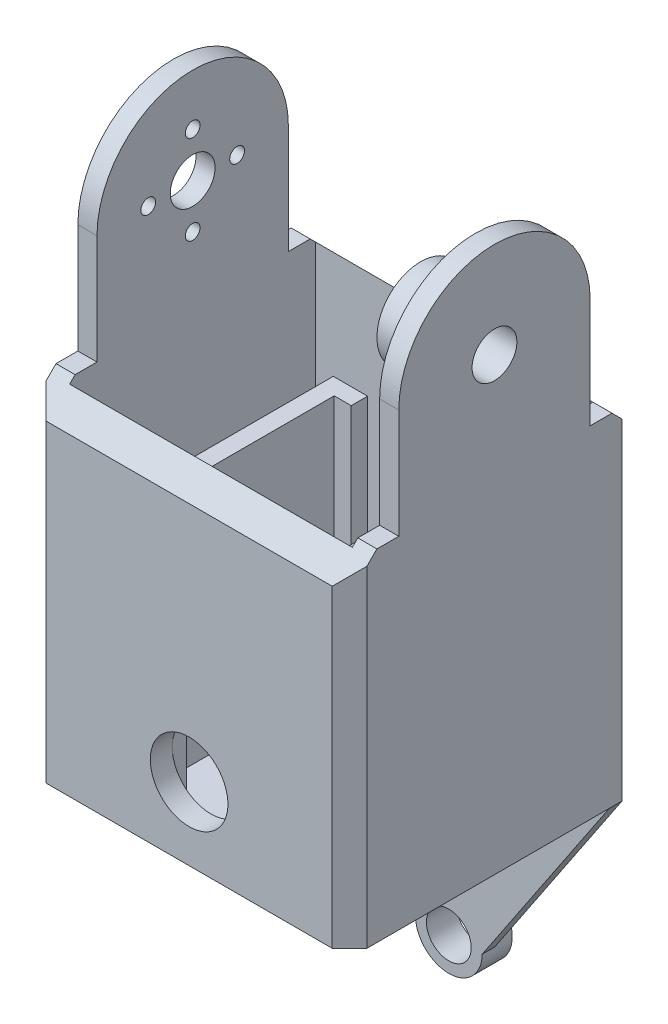
from build123d import *

# Parameters (mm, degrees)
SKETCH1_R                = 4.1
BOSS_EXTRUDE1_DEPTH      = 3.5
BOSS_EXTRUDE2_DEPTH      = 51.7
BOSS_EXTRUDE2_DEPTH_BACK = 3.5
CHAMFER2_SIZE            = 5
CUT_EXTRUDE1_REACH       = 112.079
SKETCH4_W                = 51.7
SKETCH4_H                = 45
BOSS_EXTRUDE3_START      = 3.5
SKETCH5_R                = 4.1
BOSS_EXTRUDE3_DEPTH      = 3.5
CUT_EXTRUDE3_REACH       = 104.062
SKETCH9_R                = 1.35
SKETCH10_W               = 58.7
SKETCH10_H               = 53
BOSS_EXTRUDE5_DEPTH      = 3.175
SKETCH26_R               = 7.1
CUT_EXTRUDE6_DEPTH       = 4
SKETCH27_W               = 3.175
SKETCH27_H               = 34.600130378
BOSS_EXTRUDE6_DEPTH      = 45.22
SKETCH29_R               = 4.1
BOSS_EXTRUDE8_DEPTH      = 5.5
CHAMFER3_SIZE            = 3.175
BOSS_EXTRUDE9_START      = 10
SKETCH30_R               = 8
SKETCH30_R_2             = 4.1
BOSS_EXTRUDE9_DEPTH      = 10
SKETCH31_R               = 0.95
CUT_EXTRUDE7_DEPTH       = 120.972242206
BOSS_EXTRUDE10_DEPTH     = 45.22
SKETCH33_W               = 5.386290257
SKETCH33_H               = 2.7
BOSS_EXTRUDE11_DEPTH     = 45.22
BOSS_EXTRUDE12_DEPTH     = 0.2


with BuildPart() as part:
    # Sketch1 → Boss-Extrude1 (new body)
    with BuildSketch(Plane(origin=(0, 0, 0), x_dir=(0, 0, -1), z_dir=(1, 0, 0))):
        with BuildLine():
            Line((-17.5, 0), (-17.5, -20))
            Line((-17.5, -20), (-22.5, -20))
            Line((-22.5, -20), (-22.5, -76))
            Line((-22.5, -76), (22.5, -76))
            Line((22.5, -76), (22.5, -20))
            Line((22.5, -20), (17.5, -20))
            Line((17.5, -20), (17.5, 0))
            ThreePointArc((17.5, 0), (0, 17.5), (-17.5, 0))
        make_face()
        Circle(SKETCH1_R, mode=Mode.SUBTRACT)
    extrude(amount=-BOSS_EXTRUDE1_DEPTH)

    # Sketch2 → Boss-Extrude2 (add, two sides: drawn at the far end of the back side and taken through both)
    with BuildSketch(Plane(origin=(0, 0, 0), x_dir=(0, 0, -1), z_dir=(1, 0, 0)).offset(-BOSS_EXTRUDE2_DEPTH_BACK)):
        Polygon((-22.5, -20), (-22.5, -76), (22.5, -76), (22.5, -20), (26.5, -20), (26.5, -79.175), (-26.5, -79.175), (-26.5, -20), align=None)
    extrude(amount=BOSS_EXTRUDE2_DEPTH + BOSS_EXTRUDE2_DEPTH_BACK)

    # Chamfer2
    chamfer2_edges = [part.edges().sort_by_distance(p)[0] for p in [
        (24.1, -20, -26.5),
        (24.1, -20, 26.5),
    ]]
    chamfer(chamfer2_edges, length=CHAMFER2_SIZE)

    # Sketch4 → Cut-Extrude1 (cut, up to next)
    with BuildSketch(Plane(origin=(0, -76, 0), x_dir=(1, 0, 0), z_dir=(0, 1, 0)), mode=Mode.PRIVATE) as cut_extrude1_sk1:
        with Locations((25.85, 0)):
            Rectangle(SKETCH4_W, SKETCH4_H)
    cut_extrude1_tool1 = extrude(cut_extrude1_sk1.sketch, amount=-CUT_EXTRUDE1_REACH, mode=Mode.PRIVATE) & part.part
    add(cut_extrude1_tool1.solids().sort_by_distance((25.85, -76, 0))[0], mode=Mode.SUBTRACT)

    # Sketch5 → Boss-Extrude3 (add)
    with BuildSketch(Plane(origin=(51.7, 0, 0), x_dir=(0, 0, -1), z_dir=(1, 0, 0)).offset(BOSS_EXTRUDE3_START)):
        with BuildLine():
            Line((21.5, -20), (17.5, -20))
            Line((17.5, -20), (17.5, 0))
            ThreePointArc((17.5, 0), (0, 17.5), (-17.5, 0))
            Line((-17.5, 0), (-17.5, -20))
            Line((-17.5, -20), (-21.5, -20))
            Line((-21.5, -20), (-26.5, -25))
            Line((-26.5, -25), (-26.5, -79.175))
            Line((-26.5, -79.175), (26.5, -79.175))
            Line((26.5, -79.175), (26.5, -25))
            Line((26.5, -25), (21.5, -20))
        make_face()
        Circle(SKETCH5_R, mode=Mode.SUBTRACT)
    extrude(amount=-BOSS_EXTRUDE3_DEPTH)

    # Sketch9 → Cut-Extrude3 (cut, up to next)
    with BuildSketch(Plane(origin=(55.2, 0, 0), x_dir=(0, 0, -1), z_dir=(1, 0, 0)), mode=Mode.PRIVATE) as cut_extrude3_sk1:
        with Locations((0, 8.125)):
            Circle(SKETCH9_R)
    cut_extrude3_tool1 = extrude(cut_extrude3_sk1.sketch, amount=-CUT_EXTRUDE3_REACH, mode=Mode.PRIVATE) & part.part
    # Sketch9 → Cut-Extrude3 (cut, up to next)
    with BuildSketch(Plane(origin=(55.2, 0, 0), x_dir=(0, 0, -1), z_dir=(1, 0, 0)), mode=Mode.PRIVATE) as cut_extrude3_sk2:
        with Locations((8.125, 0)):
            Circle(SKETCH9_R)
    cut_extrude3_tool2 = extrude(cut_extrude3_sk2.sketch, amount=-CUT_EXTRUDE3_REACH, mode=Mode.PRIVATE) & part.part
    # Sketch9 → Cut-Extrude3 (cut, up to next)
    with BuildSketch(Plane(origin=(55.2, 0, 0), x_dir=(0, 0, -1), z_dir=(1, 0, 0)), mode=Mode.PRIVATE) as cut_extrude3_sk3:
        with Locations((0, -8.125)):
            Circle(SKETCH9_R)
    cut_extrude3_tool3 = extrude(cut_extrude3_sk3.sketch, amount=-CUT_EXTRUDE3_REACH, mode=Mode.PRIVATE) & part.part
    # Sketch9 → Cut-Extrude3 (cut, up to next)
    with BuildSketch(Plane(origin=(55.2, 0, 0), x_dir=(0, 0, -1), z_dir=(1, 0, 0)), mode=Mode.PRIVATE) as cut_extrude3_sk4:
        with Locations((-8.125, 0)):
            Circle(SKETCH9_R)
    cut_extrude3_tool4 = extrude(cut_extrude3_sk4.sketch, amount=-CUT_EXTRUDE3_REACH, mode=Mode.PRIVATE) & part.part
    add(cut_extrude3_tool1.solids().sort_by_distance((55.2, 8.125, 0))[0], mode=Mode.SUBTRACT)
    add(cut_extrude3_tool2.solids().sort_by_distance((55.2, 0, -8.125))[0], mode=Mode.SUBTRACT)
    add(cut_extrude3_tool3.solids().sort_by_distance((55.2, -8.125, 0))[0], mode=Mode.SUBTRACT)
    add(cut_extrude3_tool4.solids().sort_by_distance((55.2, 0, 8.125))[0], mode=Mode.SUBTRACT)

    # Sketch10 → Boss-Extrude5 (add)
    with BuildSketch(Plane.XZ.offset(79.175)):
        with Locations((25.85, 0)):
            Rectangle(SKETCH10_W, SKETCH10_H)
    extrude(amount=BOSS_EXTRUDE5_DEPTH)

    # Sketch26 → Cut-Extrude6 (cut)
    with BuildSketch(Plane.XY.offset(26.5)):
        with Locations((25.85, -69.065)):
            Circle(SKETCH26_R)
    extrude(amount=-CUT_EXTRUDE6_DEPTH, mode=Mode.SUBTRACT)

    # Sketch27 → Boss-Extrude6 (add)
    with BuildSketch(Plane(origin=(0, -79.175, 0), x_dir=(1, 0, 0), z_dir=(0, 1, 0))):
        with Locations((39.993724488, -5.199934811)):
            Rectangle(SKETCH27_W, SKETCH27_H)
        with Locations((11.706275512, -5.199934811)):
            Rectangle(SKETCH27_W, SKETCH27_H)
    extrude(amount=BOSS_EXTRUDE6_DEPTH)

    # Sketch29 → Boss-Extrude8 (add)
    with BuildSketch(Plane(origin=(0, 0, -26.5), x_dir=(-1, 0, 0), z_dir=(0, 0, -1))):
        with BuildLine():
            Line((-40.997321429, -82.35), (-55.2, -82.35))
            Line((-55.2, -82.35), (-31.95, -117.07))
            ThreePointArc((-31.95, -117.07), (-25.85, -123.17), (-19.75, -117.07))
            Line((-19.75, -117.07), (3.5, -82.35))
            Line((3.5, -82.35), (-10.702678571, -82.35))
            Line((-10.702678571, -82.35), (-10.702678571, -88.35))
            Line((-10.702678571, -88.35), (-20.85, -103.503333333))
            Line((-20.85, -103.503333333), (-30.85, -103.503333333))
            Line((-30.85, -103.503333333), (-40.997321429, -88.35))
            Line((-40.997321429, -88.35), (-40.997321429, -82.35))
        make_face()
        with Locations(Location((-25.85, -117.07, 0), (0, 0, 90))):
            Circle(SKETCH29_R, mode=Mode.SUBTRACT)
    extrude(amount=-BOSS_EXTRUDE8_DEPTH)

    # Chamfer3
    chamfer3_edges = [part.edges().sort_by_distance(p)[0] for p in [
        (43.575, -99.71, -26.5),
        (8.125, -99.71, -26.5),
        (-3.5, -53.675, -26.5),
        (-3.5, -53.675, 26.5),
        (55.2, -53.675, 26.5),
        (55.2, -53.675, -26.5),
    ]]
    chamfer(chamfer3_edges, length=CHAMFER3_SIZE)

    # Sketch30 → Boss-Extrude9 (add)
    with BuildSketch(Plane(origin=(0, 0, 0), x_dir=(0, 0, -1), z_dir=(1, 0, 0)).offset(BOSS_EXTRUDE9_START)):
        Circle(SKETCH30_R)
        Circle(SKETCH30_R_2, mode=Mode.SUBTRACT)
    extrude(amount=-BOSS_EXTRUDE9_DEPTH)

    # Sketch31 → Cut-Extrude7 (cut, through all)
    with BuildSketch(Plane(origin=(0, -20, 0), x_dir=(1, 0, 0), z_dir=(0, 1, 0))):
        with Locations(Location((5, 0, 0), (0, 0, 90))):
            Circle(SKETCH31_R)
    extrude(amount=CUT_EXTRUDE7_DEPTH, mode=Mode.SUBTRACT)

    # Sketch32 → Boss-Extrude10 (add)
    with BuildSketch(Plane(origin=(0, -79.175, 0), x_dir=(1, 0, 0), z_dir=(0, 1, 0))):
        Polygon((13.293775512, 12.600036526), (16.4, 12.600036526), (16.4, 15.600130378), (10.118775512, 15.600130378), (10.118775512, 12.100130378), (13.293775512, 12.100130378), align=None)
    boss_extrude10 = extrude(amount=BOSS_EXTRUDE10_DEPTH)

    # Sketch33 → Boss-Extrude11 (add)
    with BuildSketch(Plane(origin=(0, -79.175, 0), x_dir=(1, 0, 0), z_dir=(0, 1, 0))):
        with Locations((15.986920641, -21.15)):
            Rectangle(SKETCH33_W, SKETCH33_H)
    boss_extrude11 = extrude(amount=BOSS_EXTRUDE11_DEPTH)

    # Mirror1: Boss-Extrude10, Boss-Extrude11 across plane
    add(boss_extrude10.mirror(Plane.ZY.offset(-25.85)))
    add(boss_extrude11.mirror(Plane.ZY.offset(-25.85)))

    # Sketch34 → Boss-Extrude12 (add)
    with BuildSketch(Plane(origin=(0, -33.955, 0), x_dir=(1, 0, 0), z_dir=(0, 1, 0))):
        Polygon((13.293775512, -19.8), (13.293775512, 12.600036526), (16.4, 12.600036526), (16.4, 15.600130378), (10.118775512, 15.600130378), (10.118775512, -22.5), (18.680065769, -22.5), (18.680065769, -19.8), align=None)
        Polygon((41.581224488, -22.5), (41.581224488, 15.600130378), (35.3, 15.600130378), (35.3, 12.600036526), (38.406224488, 12.600036526), (38.406224488, -19.8), (33.019934231, -19.8), (33.019934231, -22.5), align=None)
    extrude(amount=BOSS_EXTRUDE12_DEPTH)


with BuildPart() as body_2:
    # Mirror3: mirrored copy
    add(part.part.mirror(Plane.ZY.offset(13.5)))


solid = body_2.part
